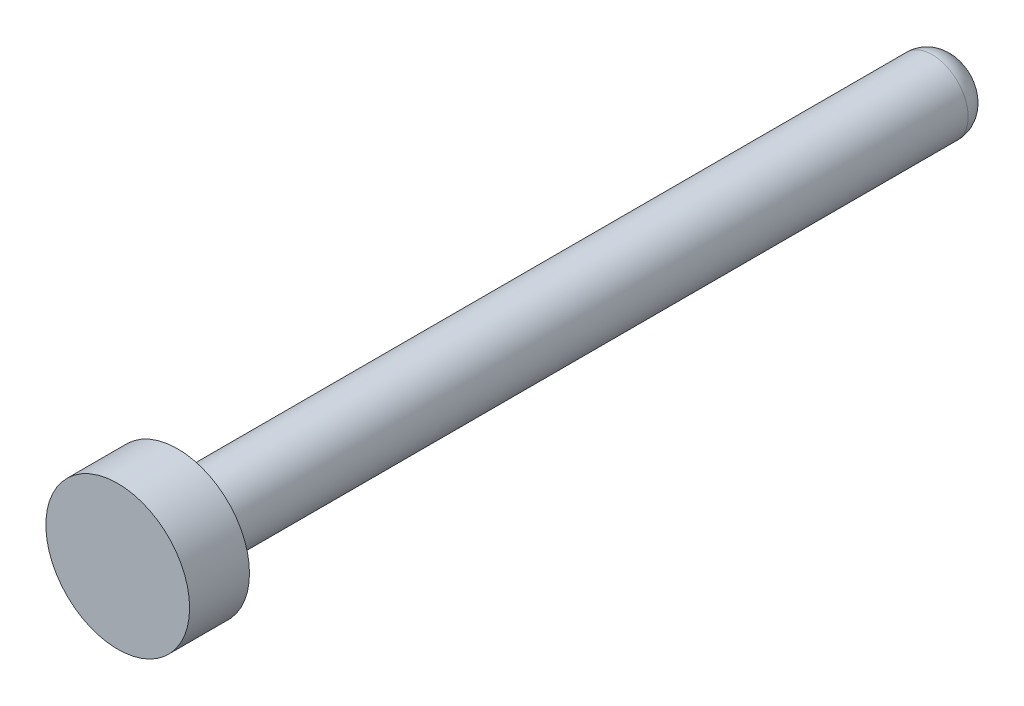
from build123d import *

# Parameters (mm, degrees)
SKETCH1_R           = 3
BOSS_EXTRUDE1_DEPTH = 65
SKETCH2_R           = 6
BOSS_EXTRUDE2_DEPTH = 5
FILLET1_R           = 2


with BuildPart() as part:
    # Sketch1 → Boss-Extrude1 (new body)
    with BuildSketch(Plane.XY):
        Circle(SKETCH1_R)
    extrude(amount=BOSS_EXTRUDE1_DEPTH)

    # Sketch2 → Boss-Extrude2 (add)
    with BuildSketch(Plane.XY.offset(65)):
        Circle(SKETCH2_R)
    extrude(amount=BOSS_EXTRUDE2_DEPTH)

    # Fillet1
    fillet1_edges = [part.edges().sort_by_distance(p)[0] for p in [
        (-3, 0, 0),
    ]]
    fillet(fillet1_edges, radius=FILLET1_R)


solid = part.part
